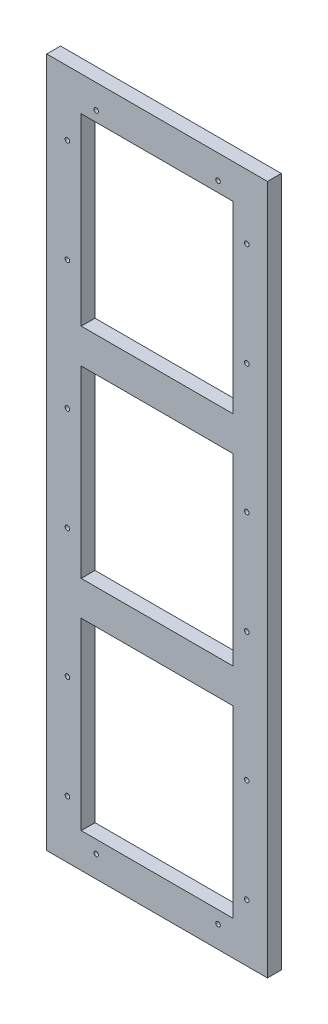
from build123d import *

# Parameters (mm, degrees)
SKETCH1_W           = 96
SKETCH1_H           = 300
SKETCH1_W_2         = 66
SKETCH1_H_2         = 80
BOSS_EXTRUDE1_DEPTH = 6
SKETCH3_R           = 1
CUT_EXTRUDE6_DEPTH  = 10
SKETCH5_R           = 1
CUT_EXTRUDE9_DEPTH  = 10


with BuildPart() as part:
    # Sketch1 → Boss-Extrude1 (new body)
    with BuildSketch(Plane.XY):
        with Locations((0, 6)):
            Rectangle(SKETCH1_W, SKETCH1_H)
        with Locations((0, 101)):
            Rectangle(SKETCH1_W_2, SKETCH1_H_2, mode=Mode.SUBTRACT)
        with Locations((0, -89)):
            Rectangle(SKETCH1_W_2, SKETCH1_H_2, mode=Mode.SUBTRACT)
        with Locations((0, 6)):
            Rectangle(SKETCH1_W_2, SKETCH1_H_2, mode=Mode.SUBTRACT)
    extrude(amount=BOSS_EXTRUDE1_DEPTH)

    # Sketch3 → Cut-Extrude6 (cut)
    with BuildSketch(Plane.XY.offset(6)):
        with Locations((-39, 128)):
            Circle(SKETCH3_R)
        with Locations((-39, 27)):
            Circle(SKETCH3_R)
        with Locations((39, 128)):
            Circle(SKETCH3_R)
        with Locations((39, 83)):
            Circle(SKETCH3_R)
        with Locations((-39, 83)):
            Circle(SKETCH3_R)
        with Locations((39, 27)):
            Circle(SKETCH3_R)
        with Locations((39, -18)):
            Circle(SKETCH3_R)
        with Locations((-39, -18)):
            Circle(SKETCH3_R)
        with Locations((-39, -74)):
            Circle(SKETCH3_R)
        with Locations((39, -74)):
            Circle(SKETCH3_R)
        with Locations((39, -119)):
            Circle(SKETCH3_R)
        with Locations((-39, -119)):
            Circle(SKETCH3_R)
    extrude(amount=-CUT_EXTRUDE6_DEPTH, mode=Mode.SUBTRACT)

    # Sketch5 → Cut-Extrude9 (cut)
    with BuildSketch(Plane.XY.offset(6)):
        with Locations((-26.5, -134.5)):
            Circle(SKETCH5_R)
        with Locations((26.5, -134.5)):
            Circle(SKETCH5_R)
        with Locations((-26.5, 145.5)):
            Circle(SKETCH5_R)
        with Locations((26.5, 145.5)):
            Circle(SKETCH5_R)
    extrude(amount=-CUT_EXTRUDE9_DEPTH, mode=Mode.SUBTRACT)


solid = part.part
